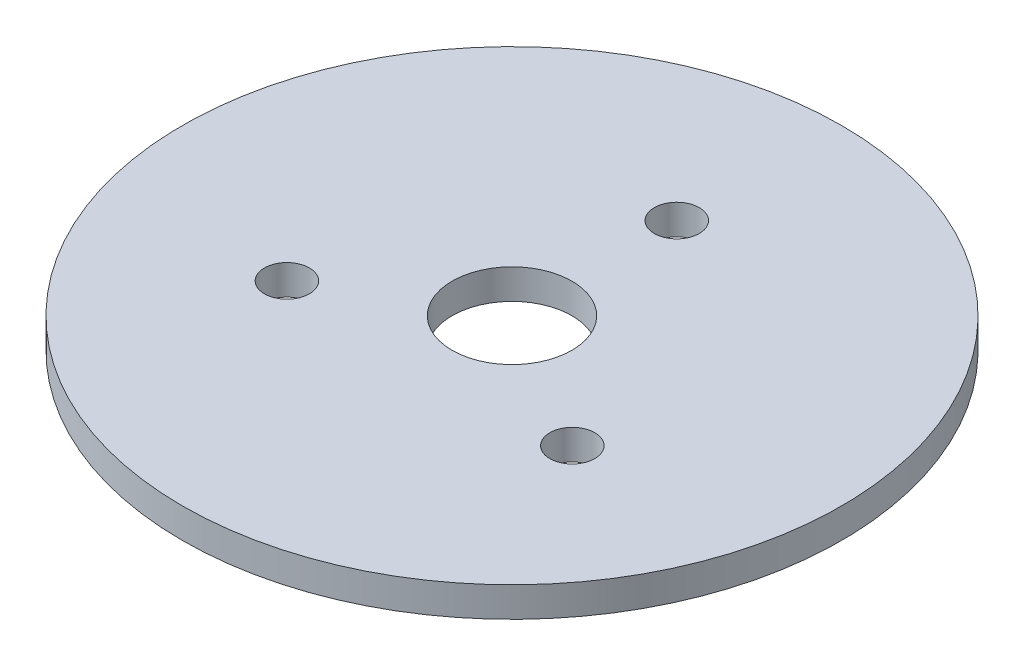
from build123d import *

# Parameters (mm, degrees)
SKETCH1_R           = 22
SKETCH1_R_2         = 4
SKETCH1_R_3         = 1.5
BOSS_EXTRUDE1_DEPTH = 2


with BuildPart() as part:
    # Sketch1 → Boss-Extrude1 (new body)
    with BuildSketch(Plane(origin=(0, 0, 0), x_dir=(1, 0, 0), z_dir=(0, 1, 0))):
        with Locations(Location((0, 0, 0), (0, 0, 270))):
            Circle(SKETCH1_R)
        with Locations(Location((0, 0, 0), (0, 0, 270))):
            Circle(SKETCH1_R_2, mode=Mode.SUBTRACT)
        with Locations(Location((0, 11, 0), (0, 0, 270))):
            Circle(SKETCH1_R_3, mode=Mode.SUBTRACT)
        with Locations(Location((9.526279442, -5.5, 0), (0, 0, 270))):
            Circle(SKETCH1_R_3, mode=Mode.SUBTRACT)
        with Locations(Location((-9.526279442, -5.5, 0), (0, 0, 270))):
            Circle(SKETCH1_R_3, mode=Mode.SUBTRACT)
    extrude(amount=BOSS_EXTRUDE1_DEPTH)


solid = part.part
